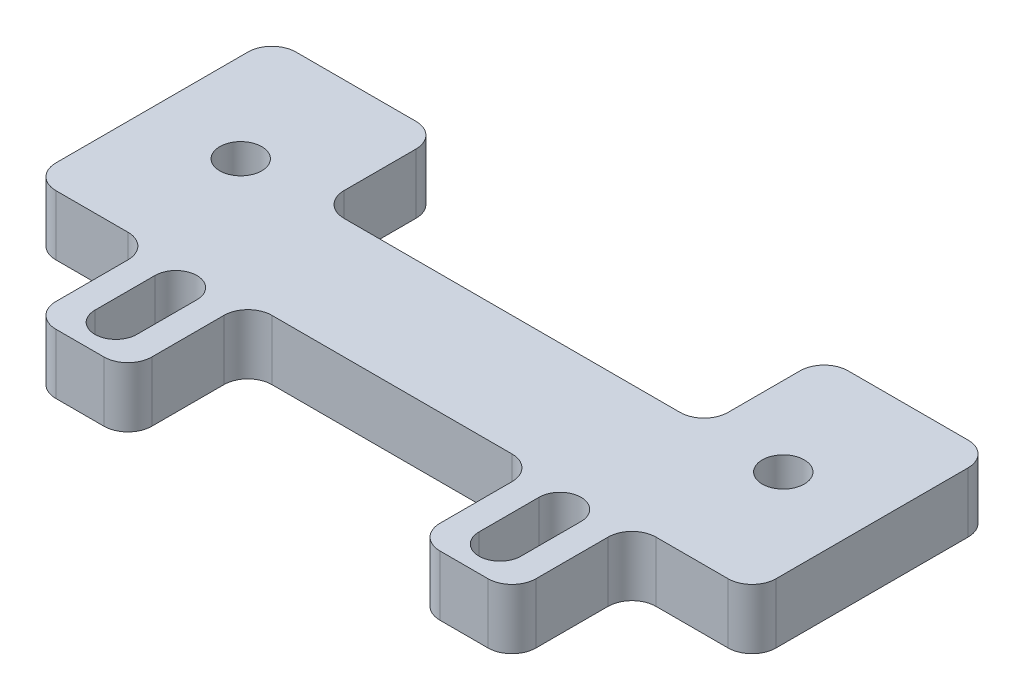
from build123d import *

# Parameters (mm, degrees)
SKETCH1_R           = 2.2225
BOSS_EXTRUDE1_DEPTH = 6.35
FILLET1_R           = 2.54


with BuildPart() as part:
    # Sketch1 → Boss-Extrude1 (new body)
    with BuildSketch(Plane(origin=(0, 0, 0), x_dir=(1, 0, 0), z_dir=(0, 1, 0))):
        Polygon((-38.1, 0), (-20.32, 0), (-20.32, -12.7), (20.32, -12.7), (20.32, 0), (38.1, 0), (38.1, -25.4), (25.4, -25.4), (25.4, -38.1), (15.24, -38.1), (15.24, -25.4), (-15.24, -25.4), (-15.24, -38.1), (-25.4, -38.1), (-25.4, -25.4), (-38.1, -25.4), align=None)
        with Locations(Location((-28.702, -12.7, 0), (0, 0, 270))):
            Circle(SKETCH1_R, mode=Mode.SUBTRACT)
        with Locations(Location((28.702, -12.7, 0), (0, 0, 270))):
            Circle(SKETCH1_R, mode=Mode.SUBTRACT)
        with BuildLine():
            Line((-18.0975, -27.94), (-18.0975, -34.29))
            ThreePointArc((-18.0975, -34.29), (-20.32, -36.5125), (-22.5425, -34.29))
            Line((-22.5425, -34.29), (-22.5425, -27.94))
            ThreePointArc((-22.5425, -27.94), (-20.32, -25.7175), (-18.0975, -27.94))
        make_face(mode=Mode.SUBTRACT)
        with BuildLine():
            Line((18.0975, -27.94), (18.0975, -34.29))
            ThreePointArc((18.0975, -34.29), (20.32, -36.5125), (22.5425, -34.29))
            Line((22.5425, -34.29), (22.5425, -27.94))
            ThreePointArc((22.5425, -27.94), (20.32, -25.7175), (18.0975, -27.94))
        make_face(mode=Mode.SUBTRACT)
    extrude(amount=BOSS_EXTRUDE1_DEPTH)

    # Fillet1
    fillet1_edges = [part.edges().sort_by_distance(p)[0] for p in [
        (38.1, 3.175, 0),
        (38.1, 3.175, 25.4),
        (25.4, 3.175, 25.4),
        (25.4, 3.175, 38.1),
        (15.24, 3.175, 38.1),
        (15.24, 3.175, 25.4),
        (-15.24, 3.175, 25.4),
        (-15.24, 3.175, 38.1),
        (-25.4, 3.175, 38.1),
        (-25.4, 3.175, 25.4),
        (-38.1, 3.175, 25.4),
        (-38.1, 3.175, 0),
        (-20.32, 3.175, 0),
        (-20.32, 3.175, 12.7),
        (20.32, 3.175, 12.7),
        (20.32, 3.175, 0),
    ]]
    fillet(fillet1_edges, radius=FILLET1_R)


solid = part.part
